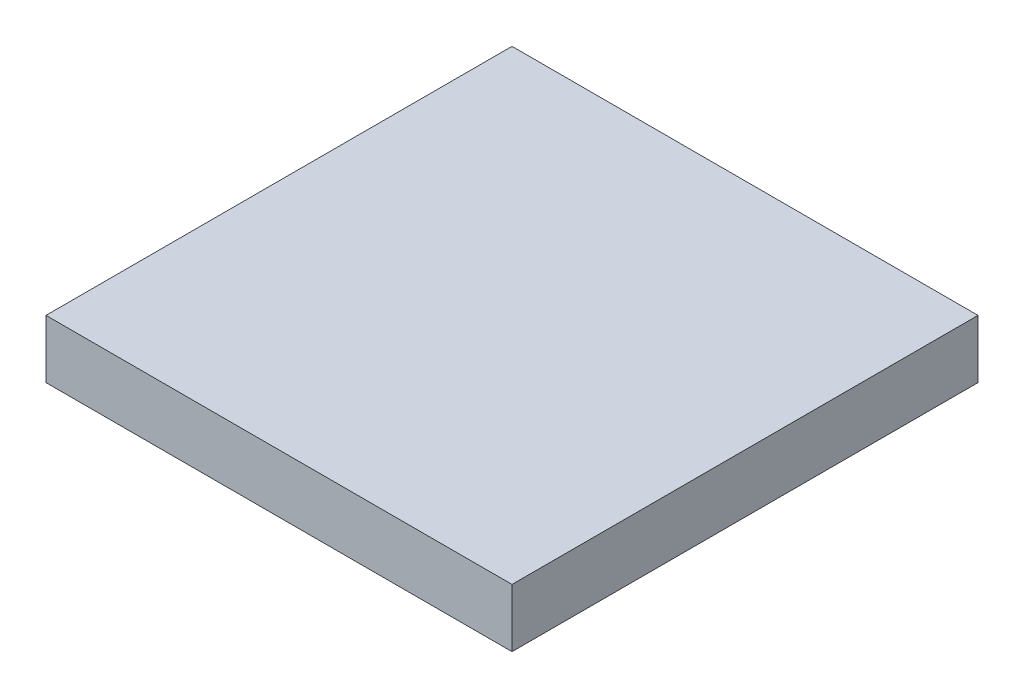
from build123d import *

# Parameters (mm, degrees)
SKETCH1_W           = 25.4
SKETCH1_H           = 3.175
BOSS_EXTRUDE1_DEPTH = 12.7


with BuildPart() as part:
    # Sketch1 → Boss-Extrude1 (new, symmetric)
    with BuildSketch(Plane.XY):
        with Locations((0, -14.2875)):
            Rectangle(SKETCH1_W, SKETCH1_H)
    extrude(amount=BOSS_EXTRUDE1_DEPTH, both=True)


solid = part.part
